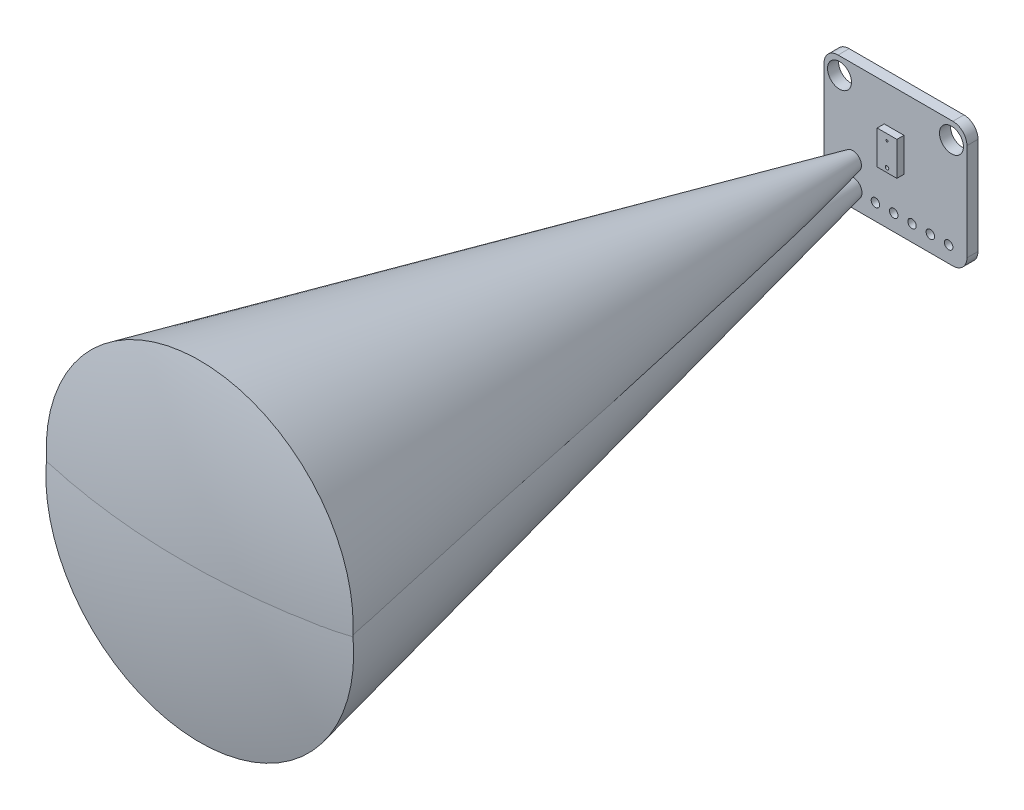
from build123d import *

# Parameters (mm, degrees)
SKETCH1_W           = 20.3
SKETCH1_H           = 17.8
BOSS_EXTRUDE1_DEPTH = 1.57
FILLET1_R           = 2
SKETCH2_R           = 1.7
SKETCH2_R_2         = 0.6
CUT_EXTRUDE1_DEPTH  = 14.590342159
SKETCH3_W           = 2.8
SKETCH3_H           = 4.8
SKETCH3_R           = 0.25
SKETCH3_R_2         = 0.15
BOSS_EXTRUDE2_DEPTH = 1


with BuildPart() as part:
    # Sketch1 → Boss-Extrude1 (new body)
    with BuildSketch(Plane.XY):
        Rectangle(SKETCH1_W, SKETCH1_H)
    extrude(amount=BOSS_EXTRUDE1_DEPTH)

    # Fillet1
    fillet1_edges = [part.edges().sort_by_distance(p)[0] for p in [
        (10.15, -8.9, 0.785),
        (10.15, 8.9, 0.785),
        (-10.15, -8.9, 0.785),
        (-10.15, 8.9, 0.785),
    ]]
    fillet(fillet1_edges, radius=FILLET1_R)

    # Sketch2 → Cut-Extrude1 (cut, through all)
    with BuildSketch(Plane.XY.offset(1.57)):
        with Locations((-7.95, 6.5)):
            Circle(SKETCH2_R)
        with Locations((7.95, 6.5)):
            Circle(SKETCH2_R)
        with Locations((-8.05, -6.6)):
            Circle(SKETCH2_R_2)
        with Locations((-5.45, -6.6)):
            Circle(SKETCH2_R_2)
        with Locations((-2.85, -6.6)):
            Circle(SKETCH2_R_2)
        with Locations((-0.25, -6.6)):
            Circle(SKETCH2_R_2)
        with Locations((2.35, -6.6)):
            Circle(SKETCH2_R_2)
        with Locations((4.95, -6.6)):
            Circle(SKETCH2_R_2)
        with Locations((7.55, -6.6)):
            Circle(SKETCH2_R_2)
    extrude(amount=-CUT_EXTRUDE1_DEPTH, mode=Mode.SUBTRACT)

    # Sketch3 → Boss-Extrude2 (add)
    with BuildSketch(Plane.XY.offset(1.57)):
        with Locations((-0.2, 1.3)):
            Rectangle(SKETCH3_W, SKETCH3_H)
        with Locations((-0.2, -0.5)):
            Circle(SKETCH3_R, mode=Mode.SUBTRACT)
        with Locations((-0.2, 2.82)):
            Circle(SKETCH3_R_2, mode=Mode.SUBTRACT)
    extrude(amount=BOSS_EXTRUDE2_DEPTH)


with BuildPart() as body_2:
    # Sketch4 → Revolve1 (revolve)
    with BuildSketch(Plane(origin=(0, 2.82, 0), x_dir=(1, 0, 0), z_dir=(0, 1, 0))):
        with BuildLine():
            Line((21.59763352, -100.182770877), (1.035870196, -7.434650201))
            ThreePointArc((1.035870196, -7.434650201), (0.421629855, -7.536061691), (-0.2, -7.57))
            Line((-0.2, -7.57), (-0.2, -102.57))
            ThreePointArc((-0.2, -102.57), (10.763982966, -101.971413822), (21.59763352, -100.182770877))
        make_face()
    revolve(axis=Axis((-0.2, 2.82, 1.86), (0, 0, 1)))


with BuildPart() as body_3:
    # Sketch5 → Revolve2 (revolve)
    with BuildSketch(Plane(origin=(0, -0.5, 0), x_dir=(1, 0, 0), z_dir=(0, 1, 0))):
        with BuildLine():
            ThreePointArc((1.098637684, -7.427776043), (0.453201249, -7.534338029), (-0.2, -7.57))
            Line((-0.2, -7.57), (-0.2, -102.57))
            ThreePointArc((-0.2, -102.57), (10.79555436, -101.96969016), (21.660401008, -100.175896719))
            Line((21.660401008, -100.175896719), (1.098637684, -7.427776043))
        make_face()
    revolve(axis=Axis((-0.2, -0.5, 18.500846939), (0, 0, -1)))


solid = Compound([part.part, body_2.part, body_3.part])
